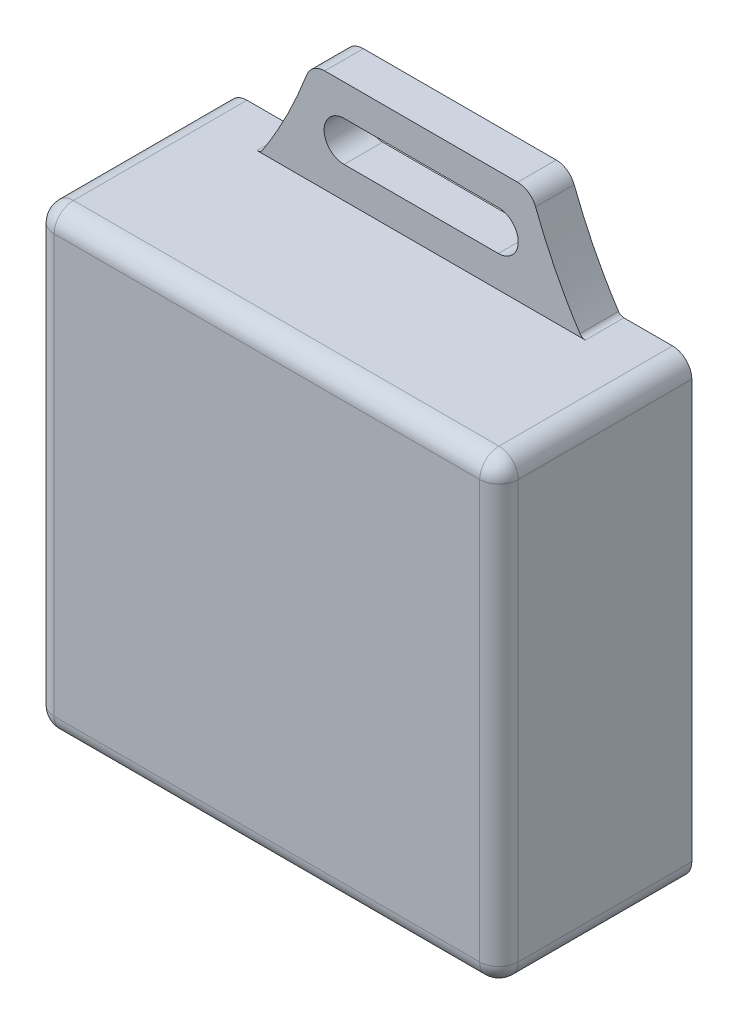
from build123d import *

# Parameters (mm, degrees)
EXTRUDE_1_DEPTH      = 3
FILLET_1_R           = 0.5
EXTRUDE_2_DEPTH      = 12
FILLET_2_R           = 1.5
CUT_EXTRUDE_1_DEPTH  = 4
EXTRUDE_3_DEPTH      = 2
EXTRUDE_3_DEPTH_BACK = 4


with BuildPart() as part:
    # 草图2 → 凸台-拉伸1 (new body)
    with BuildSketch(Plane.XY):
        with BuildLine():
            ThreePointArc((-7.5, 0), (-8.349754016, -0.263910152), (-8.900496416, -0.96277585))
            add(Edge.make_bspline(
                [(-8.900496416, -0.96277585), (-9.890641619, -3.543997872), (-11.090476147, -5.889739255), (-12.5, -8)],
                knots=[0.057327247, 0.057327247, 0.057327247, 0.057327247, 0.826256539, 0.826256539, 0.826256539, 0.826256539], degree=3))
            Line((-12.5, -8), (-16.55, -8))
            ThreePointArc((-16.55, -8), (-17.610660172, -8.439339828), (-18.05, -9.5))
            Line((-18.05, -9.5), (-18.05, -42))
            ThreePointArc((-18.05, -42), (-17.610660172, -43.060660172), (-16.55, -43.5))
            Line((-16.55, -43.5), (-12.5, -43.5))
            add(Edge.make_bspline(
                [(-8.900496416, -50.53722415), (-9.890641619, -47.956002128), (-11.090476147, -45.610260745), (-12.5, -43.5)],
                knots=[0.057327247, 0.057327247, 0.057327247, 0.057327247, 0.826256539, 0.826256539, 0.826256539, 0.826256539], degree=3))
            ThreePointArc((-8.900496416, -50.53722415), (-8.349754016, -51.236089848), (-7.5, -51.5))
            Line((-7.5, -51.5), (7.5, -51.5))
            ThreePointArc((7.5, -51.5), (8.349754016, -51.236089848), (8.900496416, -50.53722415))
            add(Edge.make_bspline(
                [(8.900496416, -50.53722415), (9.890641619, -47.956002128), (11.090476147, -45.610260745), (12.5, -43.5)],
                knots=[0.057327247, 0.057327247, 0.057327247, 0.057327247, 0.826256539, 0.826256539, 0.826256539, 0.826256539], degree=3))
            Line((12.5, -43.5), (16.55, -43.5))
            ThreePointArc((16.55, -43.5), (17.610660172, -43.060660172), (18.05, -42))
            Line((18.05, -42), (18.05, -9.5))
            ThreePointArc((18.05, -9.5), (17.610660172, -8.439339828), (16.55, -8))
            Line((16.55, -8), (12.5, -8))
            add(Edge.make_bspline(
                [(8.900496416, -0.96277585), (9.890641619, -3.543997872), (11.090476147, -5.889739255), (12.5, -8)],
                knots=[0.057327247, 0.057327247, 0.057327247, 0.057327247, 0.826256539, 0.826256539, 0.826256539, 0.826256539], degree=3))
            ThreePointArc((8.900496416, -0.96277585), (8.349754016, -0.263910152), (7.5, 0))
            Line((7.5, 0), (-7.5, 0))
        make_face()
        with BuildLine():
            Line((-6, -2.45), (6, -2.45))
            ThreePointArc((6, -2.45), (7.55, -4), (6, -5.55))
            Line((6, -5.55), (-6, -5.55))
            ThreePointArc((-6, -5.55), (-7.55, -4), (-6, -2.45))
        make_face(mode=Mode.SUBTRACT)
        with BuildLine():
            Line((-6, -45.95), (6, -45.95))
            ThreePointArc((6, -45.95), (7.55, -47.5), (6, -49.05))
            Line((6, -49.05), (-6, -49.05))
            ThreePointArc((-6, -49.05), (-7.55, -47.5), (-6, -45.95))
        make_face(mode=Mode.SUBTRACT)
    extrude(amount=EXTRUDE_1_DEPTH)

    # 圆角1
    fillet_1_edges = [part.edges().sort_by_distance(p)[0] for p in [
        (12.5, -43.5, 1.5),
        (-12.5, -43.5, 1.5),
        (-12.5, -8, 1.5),
        (12.5, -8, 1.5),
    ]]
    fillet(fillet_1_edges, radius=FILLET_1_R)

    # 草图3 → 凸台-拉伸2 (add)
    with BuildSketch(Plane.XY.offset(3)):
        with BuildLine():
            Line((0, -8), (16.55, -8))
            ThreePointArc((16.55, -8), (17.610660172, -8.439339828), (18.05, -9.5))
            Line((18.05, -9.5), (18.05, -42))
            ThreePointArc((18.05, -42), (17.610660172, -43.060660172), (16.55, -43.5))
            Line((16.55, -43.5), (14.659338555, -43.5))
            Line((14.659338555, -43.5), (-16.55, -43.5))
            ThreePointArc((-16.55, -43.5), (-17.610660172, -43.060660172), (-18.05, -42))
            Line((-18.05, -42), (-18.05, -25.75))
            Line((-18.05, -25.75), (-18.05, -9.5))
            ThreePointArc((-18.05, -9.5), (-17.610660172, -8.439339828), (-16.55, -8))
            Line((-16.55, -8), (0, -8))
        make_face()
    extrude(amount=EXTRUDE_2_DEPTH)

    # 圆角2
    fillet_2_edges = [part.edges().sort_by_distance(p)[0] for p in [
        (17.610660172, -8.439339828, 15),
        (18.05, -25.75, 15),
        (17.610660172, -43.060660172, 15),
        (0, -43.5, 15),
        (-17.610660172, -43.060660172, 15),
        (-18.05, -25.75, 15),
        (-17.610660172, -8.439339828, 15),
        (0, -8, 15),
    ]]
    fillet(fillet_2_edges, radius=FILLET_2_R)

    # 草图4 → 切除-拉伸1 (cut)
    with BuildSketch(Plane.ZY.offset(18.05)):
        Polygon((8.5, -28.75), (8.5, -25.75), (8.5, -22.75), (6.5, -22.75), (6.5, -28.75), align=None)
    extrude(amount=-CUT_EXTRUDE_1_DEPTH, mode=Mode.SUBTRACT)

    # 草图4<3> → 凸台-拉伸3 (add, two sides: drawn at the far end of the back side and taken through both)
    with BuildSketch(Plane.ZY.offset(18.05).offset(-EXTRUDE_3_DEPTH_BACK)):
        Polygon((8.25, -28.5), (8.25, -25.75), (7.5, -25.75), (6.75, -25.75), (6.75, -28.5), align=None)
    extrude(amount=EXTRUDE_3_DEPTH + EXTRUDE_3_DEPTH_BACK)


solid = part.part
